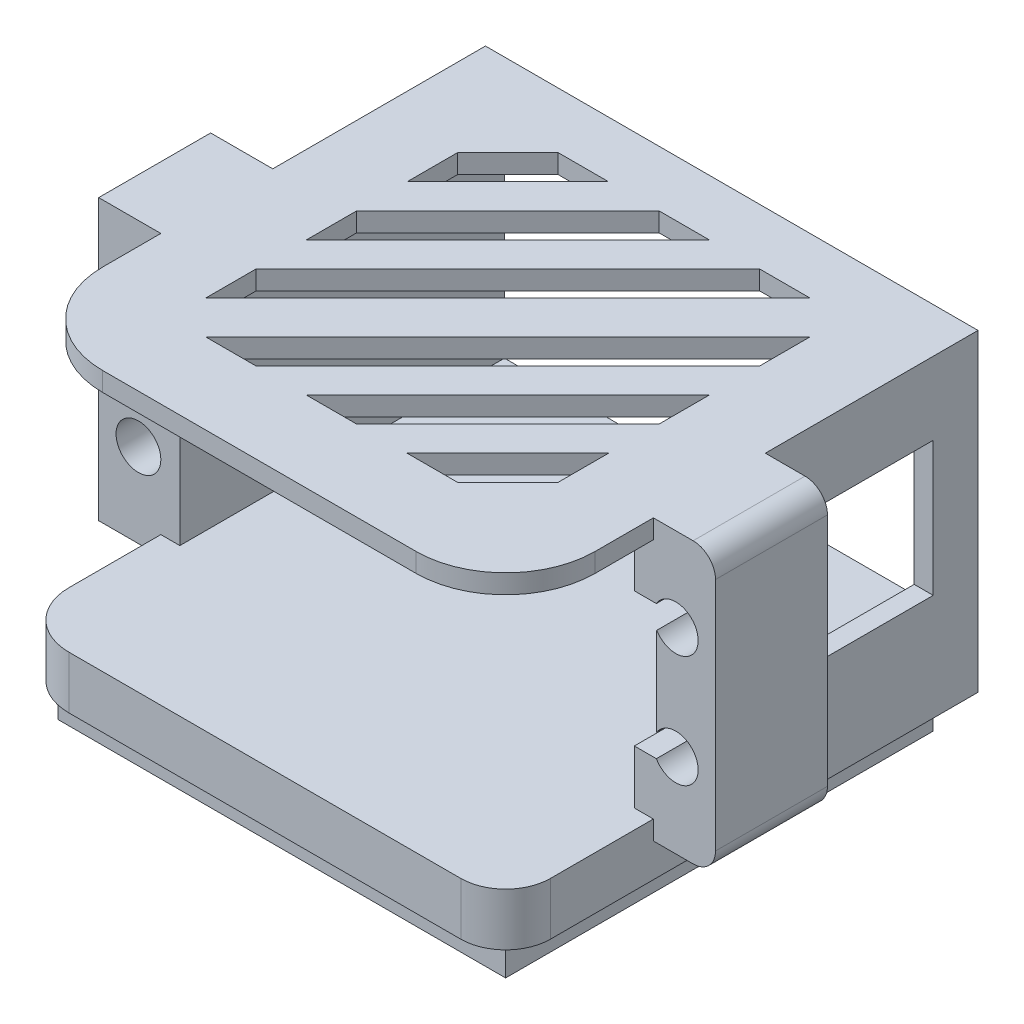
from build123d import *

# Parameters (mm, degrees)
SKETCH_1_W           = 44
SKETCH_1_H           = 25
SKETCH_1_W_2         = 40.6
SKETCH_1_H_2         = 21.6
EXTRUDE_1_DEPTH      = 44.2
SKETCH_2_W           = 5.55
SKETCH_2_H           = 25
EXTRUDE_2_DEPTH      = 10
SKETCH_3_W           = 44
SKETCH_3_H           = 21.6
CUT_EXTRUDE_1_DEPTH  = 13.2
SKETCH_4_R           = 2
CUT_EXTRUDE_2_DEPTH  = 10
FILLET_1_R           = 2
SKETCH_5_W           = 44
SKETCH_5_H           = 44.2
EXTRUDE_3_DEPTH      = 6
SKETCH_9_R           = 1
EXTRUDE_4_DEPTH      = 2
EXTRUDE_5_DEPTH      = 1.5
SKETCH_12_R          = 35.05
SKETCH_12_R_2        = 32.9
CUT_EXTRUDE_6_DEPTH  = 1
SKETCH_13_R          = 1.5
CUT_EXTRUDE_7_DEPTH  = 30
SKETCH_14_W          = 2
SKETCH_14_H          = 12
CUT_EXTRUDE_8_DEPTH  = 25
FILLET_2_R           = 8
SKETCH_16_R          = 7.216878365
CUT_EXTRUDE_10_DEPTH = 10
FILLET_3_R           = 4
CUT_EXTRUDE_11_REACH = 107.631
SKETCH_17_W          = 44
SKETCH_17_H          = 2
SKETCH_21_W          = 227.693891034
SKETCH_21_H          = 191.913422443
CUT_EXTRUDE_15_DEPTH = 16
CUT_EXTRUDE_17_DEPTH = 10
SKETCH_31_W          = 40
SKETCH_31_H          = 38.2
EXTRUDE_10_DEPTH     = 3
CUT_EXTRUDE_18_DEPTH = 2


with BuildPart() as part:
    # 草图1 → 凸台-拉伸1 (new body)
    with BuildSketch(Plane.XY):
        Rectangle(SKETCH_1_W, SKETCH_1_H)
        Rectangle(SKETCH_1_W_2, SKETCH_1_H_2, mode=Mode.SUBTRACT)
    extrude(amount=-EXTRUDE_1_DEPTH)

    # 草图2 → 凸台-拉伸2 (add)
    with BuildSketch(Plane(origin=(0, 0, -13.2), x_dir=(-1, 0, 0), z_dir=(0, 0, -1))):
        with Locations((-24.775, 0)):
            Rectangle(SKETCH_2_W, SKETCH_2_H)
        with Locations((24.775, 0)):
            Rectangle(SKETCH_2_W, SKETCH_2_H)
    extrude(amount=EXTRUDE_2_DEPTH)

    # 草图3 → 切除-拉伸1 (cut)
    with BuildSketch(Plane.XY):
        Rectangle(SKETCH_3_W, SKETCH_3_H)
    extrude(amount=-CUT_EXTRUDE_1_DEPTH, mode=Mode.SUBTRACT)

    # 草图4 → 切除-拉伸2 (cut)
    with BuildSketch(Plane.XY.offset(-13.2)):
        with Locations((24, 5)):
            Circle(SKETCH_4_R)
        with Locations((24, -5)):
            Circle(SKETCH_4_R)
        with Locations((-24, 5)):
            Circle(SKETCH_4_R)
        with Locations((-24, -5)):
            Circle(SKETCH_4_R)
    extrude(amount=-CUT_EXTRUDE_2_DEPTH, mode=Mode.SUBTRACT)

    # 圆角1
    fillet_1_edges = [part.edges().sort_by_distance(p)[0] for p in [
        (27.55, 12.5, -18.2),
        (27.55, -12.5, -18.2),
    ]]
    fillet(fillet_1_edges, radius=FILLET_1_R)

    # 草图5 → 凸台-拉伸3 (add)
    with BuildSketch(Plane.XZ.offset(12.5)):
        with Locations((0, -22.1)):
            Rectangle(SKETCH_5_W, SKETCH_5_H)
    extrude(amount=EXTRUDE_3_DEPTH)

    # 草图9 → 凸台-拉伸4 (add)
    with BuildSketch(Plane.XZ.offset(18.5)):
        Polygon((-46.27864045, -52.2), (33.72135955, -52.2), (58.4427191, 23.884521304), (-6.27864045, 70.907341487), (-71, 23.884521304), align=None)
        with Locations(Location((-6.27864045, 2.855276819, 0), (0, 0, 270))):
            Circle(SKETCH_9_R, mode=Mode.SUBTRACT)
    extrude(amount=EXTRUDE_4_DEPTH)

    # 草图10 → 凸台-拉伸5 (add)
    with BuildSketch(Plane(origin=(0, -18.5, 0), x_dir=(1, 0, 0), z_dir=(0, 1, 0))):
        Polygon((-64.534362225, -21.783708242), (-6.27864045, -64.108967611), (51.977081325, -21.783708242), (29.725375646, 46.7), (-42.282656546, 46.7), align=None)
        Polygon((-62.183221216, -21.019776219), (-6.27864045, -61.636831656), (49.625940316, -21.019776219), (28.27229059, 44.7), (-40.82957149, 44.7), align=None, mode=Mode.SUBTRACT)
    extrude(amount=EXTRUDE_5_DEPTH)

    # 草图12 → 切除-拉伸6 (cut)
    with BuildSketch(Plane.XZ.offset(20.5)):
        with Locations(Location((-6.27864045, 2.855276819, 0), (0, 0, 270))):
            Circle(SKETCH_12_R)
        with Locations(Location((-6.27864045, 2.855276819, 0), (0, 0, 270))):
            Circle(SKETCH_12_R_2, mode=Mode.SUBTRACT)
    extrude(amount=-CUT_EXTRUDE_6_DEPTH, mode=Mode.SUBTRACT)

    # 草图13 → 切除-拉伸7 (cut)
    with BuildSketch(Plane.XZ.offset(20.5)):
        with Locations(Location((-6.27864045, 65.855276819, 0), (0, 0, 270))):
            Circle(SKETCH_13_R)
        with Locations(Location((53.637920077, 22.323347464, 0), (0, 0, 270))):
            Circle(SKETCH_13_R)
        with Locations(Location((30.751830444, -48.112793827, 0), (0, 0, 270))):
            Circle(SKETCH_13_R)
        with Locations(Location((-43.309111344, -48.112793827, 0), (0, 0, 270))):
            Circle(SKETCH_13_R)
        with Locations(Location((-66.195200977, 22.323347464, 0), (0, 0, 270))):
            Circle(SKETCH_13_R)
    extrude(amount=-CUT_EXTRUDE_7_DEPTH, mode=Mode.SUBTRACT)

    # 草图14 → 切除-拉伸8 (cut)
    with BuildSketch(Plane.XY.offset(-13.2)):
        with Locations((21.3, 0)):
            Rectangle(SKETCH_14_W, SKETCH_14_H)
    extrude(amount=-CUT_EXTRUDE_8_DEPTH, mode=Mode.SUBTRACT)

    # 圆角2
    fillet_2_edges = [part.edges().sort_by_distance(p)[0] for p in [
        (-22, 11.65, 0),
        (22, 11.65, 0),
    ]]
    fillet(fillet_2_edges, radius=FILLET_2_R)

    # 草图16 → 切除-拉伸10 (cut)
    with BuildSketch(Plane(origin=(0, -18.5, 0), x_dir=(1, 0, 0), z_dir=(0, 1, 0))):
        with Locations(Location((-14.634879376, -12.813854579, 0), (0, 0, 270))):
            Circle(SKETCH_16_R)
    extrude(amount=-CUT_EXTRUDE_10_DEPTH, mode=Mode.SUBTRACT)

    # 圆角3
    fillet_3_edges = [part.edges().sort_by_distance(p)[0] for p in [
        (-22, -14.65, 0),
        (22, -14.65, 0),
    ]]
    fillet(fillet_3_edges, radius=FILLET_3_R)

    # 切除-拉伸11: up to this face of the body (flat: up to its plane)
    cut_extrude_11_end = Plane(part.part.faces().sort_by_distance((23.543010381, -18.5, -24.1))[0])
    # 草图17 → 切除-拉伸11 (cut, up to the picked face)
    with BuildSketch(Plane(origin=(0, 12.5, 0), x_dir=(1, 0, 0), z_dir=(0, 1, 0)), mode=Mode.PRIVATE) as cut_extrude_11_sk1:
        with Locations((0, 43.2)):
            Rectangle(SKETCH_17_W, SKETCH_17_H)
    cut_extrude_11_tool1 = split(extrude(cut_extrude_11_sk1.sketch, amount=-CUT_EXTRUDE_11_REACH, mode=Mode.PRIVATE), bisect_by=cut_extrude_11_end, keep=Keep.BOTH, mode=Mode.PRIVATE)
    add(cut_extrude_11_tool1.solids().sort_by(Axis((0, 12.5, -43.2), (0, -1, 0)))[0], mode=Mode.SUBTRACT)

    # 草图21 → 切除-拉伸15 (cut)
    with BuildSketch(Plane(origin=(0, -15.5, 0), x_dir=(1, 0, 0), z_dir=(0, 1, 0))):
        with Locations((-2.520580865, -1.129519683)):
            Rectangle(SKETCH_21_W, SKETCH_21_H)
    extrude(amount=-CUT_EXTRUDE_15_DEPTH, mode=Mode.SUBTRACT)

    # 草图25 → 切除-拉伸17 (cut)
    with BuildSketch(Plane(origin=(0, -10.8, 0), x_dir=(1, 0, 0), z_dir=(0, 1, 0))):
        with BuildLine():
            Line((-22, 5), (-22, 0))
            Line((-22, 0), (-17, 0))
            ThreePointArc((-17, 0), (-20.535533906, 1.464466094), (-22, 5))
        make_face()
    extrude(amount=-CUT_EXTRUDE_17_DEPTH, mode=Mode.SUBTRACT)

    # 草图31 → 凸台-拉伸10 (add)
    with BuildSketch(Plane.XZ.offset(15.5)):
        with Locations((0, -21.1)):
            Rectangle(SKETCH_31_W, SKETCH_31_H)
    extrude(amount=EXTRUDE_10_DEPTH)

    # 草图32 → 切除-拉伸18 (cut)
    with BuildSketch(Plane(origin=(0, 12.5, 0), x_dir=(1, 0, 0), z_dir=(0, 1, 0))):
        Polygon((-10.5, 37.2), (-15, 32.7), (-15, 28.2), (-6, 37.2), align=None)
        Polygon((-1.5, 37.2), (-15, 23.7), (-15, 19.2), (3, 37.2), align=None)
        Polygon((7.5, 37.2), (-15, 14.7), (-15, 10.2), (12, 37.2), align=None)
        Polygon((-7.5, 7.2), (-12, 7.2), (15, 34.2), (15, 29.7), align=None)
        Polygon((1.5, 7.2), (-3, 7.2), (15, 25.2), (15, 20.7), align=None)
        Polygon((15, 16.2), (15, 11.7), (10.5, 7.2), (6, 7.2), align=None)
    extrude(amount=-CUT_EXTRUDE_18_DEPTH, mode=Mode.SUBTRACT)


solid = part.part
